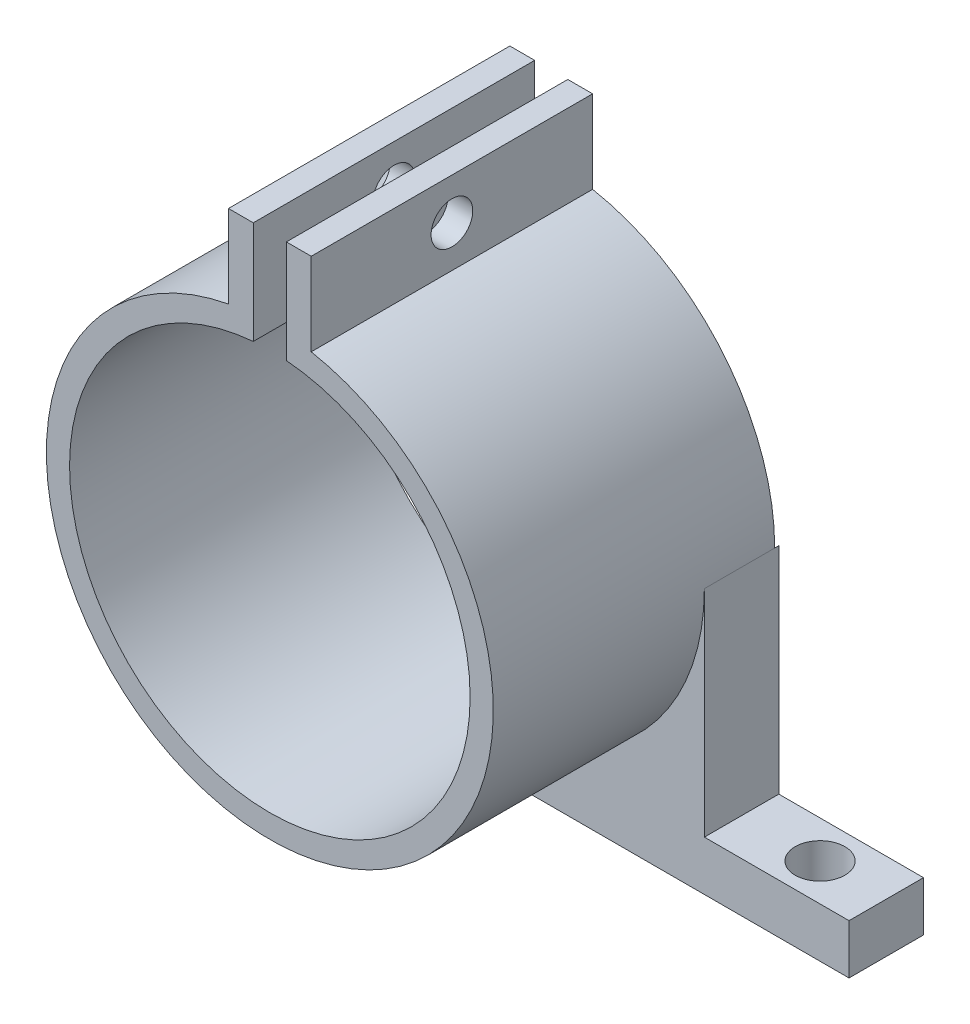
from build123d import *

# Parameters (mm, degrees)
SKETCH1_W                = 44.48
SKETCH1_H                = 4.5
SKETCH1_R                = 1.5
BOSS_EXTRUDE1_DEPTH      = 3
BOSS_EXTRUDE2_DEPTH      = 15
BOSS_EXTRUDE2_DEPTH_BACK = 2
BOSS_EXTRUDE3_DEPTH      = 2.25
CUT_EXTRUDE1_DEPTH       = 44.517933829
CUT_EXTRUDE1_DEPTH_BACK  = 44.517933829
SKETCH3_R                = 1.258736144


with BuildPart() as part:
    # Sketch1 → Boss-Extrude1 (new body)
    with BuildSketch(Plane(origin=(0, 0, 0), x_dir=(1, 0, 0), z_dir=(0, 1, 0))):
        Rectangle(SKETCH1_W, SKETCH1_H)
        with Locations((-18.24, 0)):
            Circle(SKETCH1_R, mode=Mode.SUBTRACT)
        with Locations((18.24, 0)):
            Circle(SKETCH1_R, mode=Mode.SUBTRACT)
    extrude(amount=BOSS_EXTRUDE1_DEPTH)

    # Sketch2 → Boss-Extrude2 (add, two sides: drawn at the far end of the back side and taken through both)
    with BuildSketch(Plane.XY.offset(-BOSS_EXTRUDE2_DEPTH_BACK)):
        with BuildLine():
            ThreePointArc((-2.5, 29.266499161), (0, 2.5), (2.5, 29.266499161))
            Line((2.5, 29.266499161), (2.5, 34.266499161))
            Line((2.5, 34.266499161), (1, 34.266499161))
            Line((1, 34.266499161), (1, 28.058606885))
            ThreePointArc((1, 28.058606885), (0, 3.9), (-1, 28.058606885))
            Line((-1, 28.058606885), (-1, 34.266499161))
            Line((-1, 34.266499161), (-2.5, 34.266499161))
            Line((-2.5, 34.266499161), (-2.5, 29.266499161))
        make_face()
    extrude(amount=BOSS_EXTRUDE2_DEPTH + BOSS_EXTRUDE2_DEPTH_BACK)

    # Sketch2<3> → Boss-Extrude3 (add, symmetric)
    with BuildSketch(Plane.XY):
        with BuildLine():
            ThreePointArc((-3.640054945, 3), (-10.756178265, 7.841897946), (-13.5, 16))
            Line((-13.5, 16), (-13.5, 3))
            Line((-13.5, 3), (-3.640054945, 3))
        make_face()
        with BuildLine():
            ThreePointArc((13.5, 16), (10.756178265, 7.841897946), (3.640054945, 3))
            Line((3.640054945, 3), (13.5, 3))
            Line((13.5, 3), (13.5, 16))
        make_face()
    extrude(amount=BOSS_EXTRUDE3_DEPTH, both=True)

    # Sketch3 → Cut-Extrude1 (cut, two sides: drawn at the far end of the back side and taken through both)
    with BuildSketch(Plane(origin=(0, 0, 0), x_dir=(0, 0, -1), z_dir=(1, 0, 0)).offset(-CUT_EXTRUDE1_DEPTH_BACK)):
        with Locations((-6.5, 31.766499161)):
            Circle(SKETCH3_R)
    extrude(amount=CUT_EXTRUDE1_DEPTH + CUT_EXTRUDE1_DEPTH_BACK, mode=Mode.SUBTRACT)


solid = part.part
